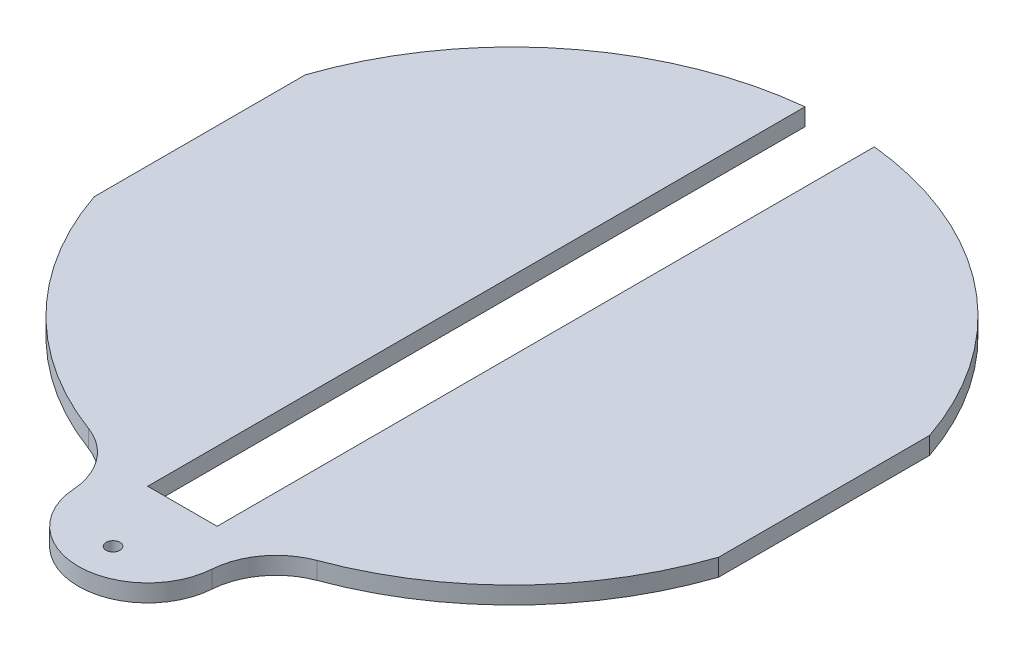
from build123d import *

# Parameters (mm, degrees)
BOSS_EXTRUDE1_DEPTH     = 3.175
SKETCH3_R               = 1.27
CUT_EXTRUDE1_DEPTH      = 96.302901976
CUT_EXTRUDE2_DEPTH      = 96.302901976
CUT_EXTRUDE2_DEPTH_BACK = 96.302901976
FILLET1_R               = 12.7


with BuildPart() as part:
    # Sketch2 → Boss-Extrude1 (new body)
    with BuildSketch(Plane(origin=(0, 0, 0), x_dir=(1, 0, 0), z_dir=(0, 1, 0))):
        with BuildLine():
            Line((6.35, 63.5), (57.15, 63.5))
            Line((57.15, 63.5), (57.15, -63.5))
            Line((57.15, -63.5), (12.7, -63.5))
            ThreePointArc((12.7, -63.5), (0, -76.2), (-12.7, -63.5))
            Line((-12.7, -63.5), (-57.15, -63.5))
            Line((-57.15, -63.5), (-57.15, 63.5))
            Line((-57.15, 63.5), (-6.35, 63.5))
            Line((-6.35, 63.5), (-6.35, -57.15))
            Line((-6.35, -57.15), (6.35, -57.15))
            Line((6.35, -57.15), (6.35, 63.5))
        make_face()
    extrude(amount=BOSS_EXTRUDE1_DEPTH)

    # Sketch3 → Cut-Extrude1 (cut, through all)
    with BuildSketch(Plane(origin=(0, 3.175, 0), x_dir=(1, 0, 0), z_dir=(0, 1, 0))):
        with Locations(Location((0, -69.85, 0), (0, 0, 270))):
            Circle(SKETCH3_R)
    extrude(amount=-CUT_EXTRUDE1_DEPTH, mode=Mode.SUBTRACT)

    # Sketch4 → Cut-Extrude2 (cut, two sides: drawn at the far end of the back side and taken through both)
    with BuildSketch(Plane(origin=(0, 3.175, 0), x_dir=(1, 0, 0), z_dir=(0, 1, 0)).offset(-CUT_EXTRUDE2_DEPTH_BACK)):
        with BuildLine():
            Line((-57.15, -63.5), (-12.7, -63.5))
            Line((-12.7, -63.5), (-12.7, -55.798007597))
            ThreePointArc((-12.7, -55.798007597), (-40.162037001, -41.837402835), (-57.15, -16.137771034))
            Line((-57.15, -16.137771034), (-57.15, -63.5))
        make_face()
        with BuildLine():
            Line((-57.15, 63.5), (-57.15, 22.487771034))
            ThreePointArc((-57.15, 22.487771034), (-37.70568739, 50.264136363), (-6.35, 63.164858518))
            Line((-6.35, 63.164858518), (-6.35, 63.5))
            Line((-6.35, 63.5), (-57.15, 63.5))
        make_face()
        with BuildLine():
            Line((57.15, -63.5), (57.15, -16.137771034))
            ThreePointArc((57.15, -16.137771034), (40.162037001, -41.837402835), (12.7, -55.798007597))
            Line((12.7, -55.798007597), (12.7, -63.5))
            Line((12.7, -63.5), (57.15, -63.5))
        make_face()
        with BuildLine():
            Line((57.15, 63.5), (6.35, 63.5))
            Line((6.35, 63.5), (6.35, 63.164858518))
            ThreePointArc((6.35, 63.164858518), (37.70568739, 50.264136363), (57.15, 22.487771034))
            Line((57.15, 22.487771034), (57.15, 63.5))
        make_face()
    extrude(amount=CUT_EXTRUDE2_DEPTH + CUT_EXTRUDE2_DEPTH_BACK, mode=Mode.SUBTRACT)

    # Fillet1
    fillet1_edges = [part.edges().sort_by_distance(p)[0] for p in [
        (12.7, 1.5875, 55.798007597),
        (-12.7, 1.5875, 55.798007597),
    ]]
    fillet(fillet1_edges, radius=FILLET1_R)


solid = part.part
